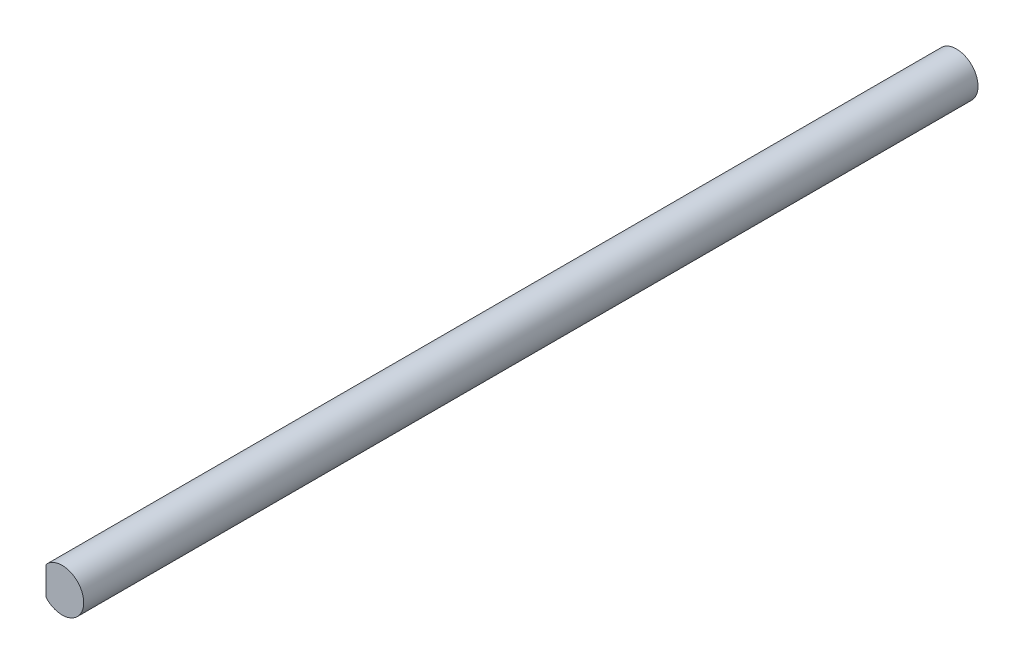
from build123d import *

# Parameters (mm, degrees)
SKETCH1_R                = 4
AXLE_166MM_DEPTH         = 166
PRINT_BED_FLAT_1MM_START = -0.1
SKETCH2_W                = 2
SKETCH2_H                = 10
PRINT_BED_FLAT_1MM_DEPTH = 166.2


with BuildPart() as part:
    # Sketch1 → Axle_166mm (new body)
    with BuildSketch(Plane.XY):
        Circle(SKETCH1_R)
    extrude(amount=AXLE_166MM_DEPTH)

    # Sketch2 → Print_Bed_Flat_1mm (cut)
    with BuildSketch(Plane.XY.offset(PRINT_BED_FLAT_1MM_START)):
        with Locations((-4, 0)):
            Rectangle(SKETCH2_W, SKETCH2_H)
    extrude(amount=PRINT_BED_FLAT_1MM_DEPTH, mode=Mode.SUBTRACT)


solid = part.part
